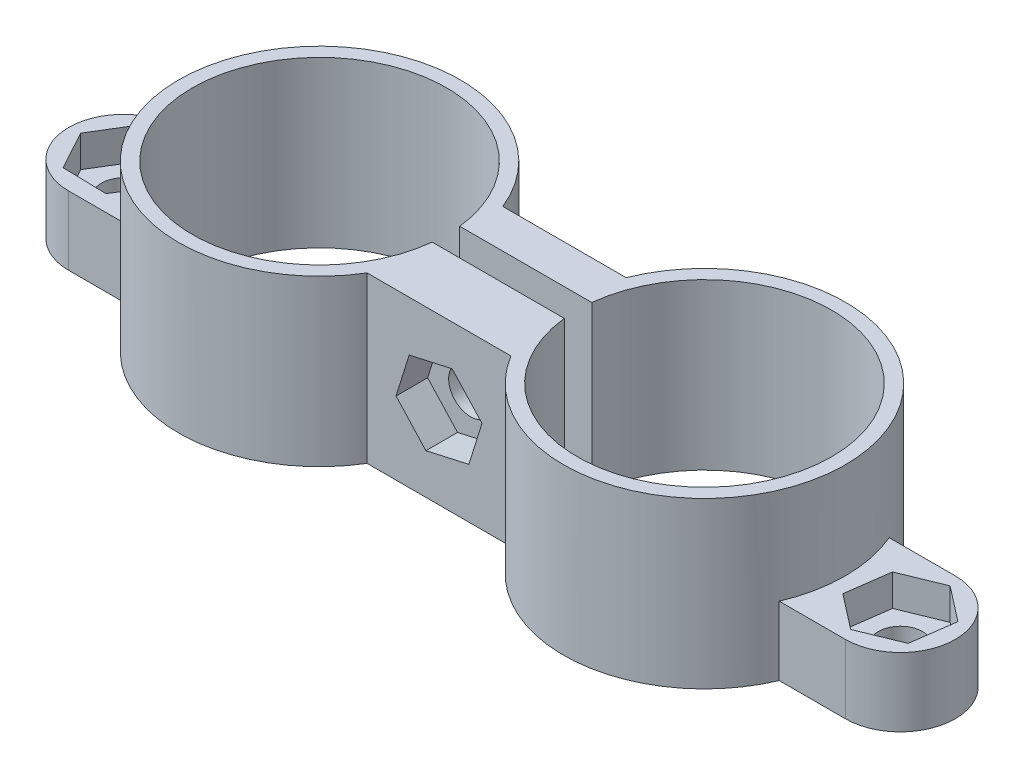
from build123d import *

# Parameters (mm, degrees)
SKETCH1_R             = 1.6
BOSS_EXTRUDE2_DEPTH   = 5
BOSS_EXTRUDE2_2_DEPTH = 5
BOSS_EXTRUDE3_DEPTH   = 12
CUT_EXTRUDE1_DEPTH    = 2.3
CUT_EXTRUDE2_DEPTH    = 2.3
SKETCH4_R             = 1.6
CUT_EXTRUDE3_DEPTH    = 15
CUT_EXTRUDE4_DEPTH    = 2.3


with BuildPart() as part:
    # Sketch1 → Boss-Extrude2 (new body)
    with BuildSketch(Plane(origin=(0, 0, 0), x_dir=(1, 0, 0), z_dir=(0, 1, 0))):
        with BuildLine():
            ThreePointArc((-9.437293044, -4), (-10.25, 0), (-9.437293044, 4))
            Line((-9.437293044, 4), (-14.25, 4))
            ThreePointArc((-14.25, 4), (-18.25, 0), (-14.25, -4))
            Line((-14.25, -4), (-9.437293044, -4))
        make_face()
        with Locations((-14.25, 0)):
            Circle(SKETCH1_R, mode=Mode.SUBTRACT)
    extrude(amount=BOSS_EXTRUDE2_DEPTH)



with BuildPart() as body_2:
    # Sketch1 → Boss-Extrude2 2 (new body)
    with BuildSketch(Plane(origin=(0, 0, 0), x_dir=(1, 0, 0), z_dir=(0, 1, 0))):
        with BuildLine():
            Line((42.25, 4), (37.437293044, 4))
            ThreePointArc((37.437293044, 4), (38.25, 0), (37.437293044, -4))
            Line((37.437293044, -4), (42.25, -4))
            ThreePointArc((42.25, -4), (46.25, 0), (42.25, 4))
        make_face()
        with Locations((42.25, 0)):
            Circle(SKETCH1_R, mode=Mode.SUBTRACT)
    extrude(amount=BOSS_EXTRUDE2_2_DEPTH)


with BuildPart() as part_1:
    add(part.part)

    add(body_2.part)  # Boss-Extrude3 merges body 2
    # Sketch1<4> → Boss-Extrude3 (add)
    with BuildSketch(Plane(origin=(0, 0, 0), x_dir=(1, 0, 0), z_dir=(0, 1, 0))):
        with BuildLine():
            Line((18.4859967, 3.813953488), (9.5140033, 3.813953488))
            ThreePointArc((9.5140033, 3.813953488), (0.100620286, 10.249506113), (-9.437293044, 4))
            ThreePointArc((-9.437293044, 4), (-10.25, 0), (-9.437293044, -4))
            ThreePointArc((-9.437293044, -4), (-0.734983861, -10.223614758), (8.768076052, -5.308798579))
            Line((8.768076052, -5.308798579), (19.231923948, -5.308798579))
            ThreePointArc((19.231923948, -5.308798579), (28.734983861, -10.223614758), (37.437293044, -4))
            ThreePointArc((37.437293044, -4), (38.25, 0), (37.437293044, 4))
            ThreePointArc((37.437293044, 4), (27.899379714, 10.249506113), (18.4859967, 3.813953488))
        make_face()
        with BuildLine():
            ThreePointArc((9.195787079, -1), (-9.25, 0), (9.195787079, 1))
            Line((9.195787079, 1), (18.804212921, 1))
            ThreePointArc((18.804212921, 1), (37.25, 0), (18.804212921, -1))
            Line((18.804212921, -1), (9.195787079, -1))
        make_face(mode=Mode.SUBTRACT)
    extrude(amount=BOSS_EXTRUDE3_DEPTH)

    # Sketch2 → Cut-Extrude1 (cut)
    with BuildSketch(Plane(origin=(0, 5, 0), x_dir=(1, 0, 0), z_dir=(0, 1, 0))):
        Polygon((-15.782040378, 2.814312044), (-17.453285913, 0.080370135), (-15.921245535, -2.733941909), (-12.717959622, -2.814312044), (-11.046714087, -0.080370135), (-12.578754465, 2.733941909), align=None)
    extrude(amount=-CUT_EXTRUDE1_DEPTH, mode=Mode.SUBTRACT)

    # Sketch3 → Cut-Extrude2 (cut)
    with BuildSketch(Plane(origin=(0, 5, 0), x_dir=(1, 0, 0), z_dir=(0, 1, 0))):
        Polygon((42.687046229, 3.180176713), (39.714409293, 1.968581494), (39.277363063, -1.211595219), (41.812953771, -3.180176713), (44.785590707, -1.968581494), (45.222636937, 1.211595219), align=None)
    extrude(amount=-CUT_EXTRUDE2_DEPTH, mode=Mode.SUBTRACT)

    # Sketch4 → Cut-Extrude3 (cut)
    with BuildSketch(Plane.XY.offset(5.308798579)):
        with Locations((14, 6)):
            Circle(SKETCH4_R)
    extrude(amount=-CUT_EXTRUDE3_DEPTH, mode=Mode.SUBTRACT)

    # Sketch7 → Cut-Extrude4 (cut)
    with BuildSketch(Plane.XY.offset(5.308798579)):
        Polygon((14.954593719, 9.05879892), (11.82829929, 8.356101871), (10.873705571, 5.297302951), (13.045406281, 2.94120108), (16.17170071, 3.643898129), (17.126294429, 6.702697049), align=None)
    extrude(amount=-CUT_EXTRUDE4_DEPTH, mode=Mode.SUBTRACT)


solid = part_1.part
